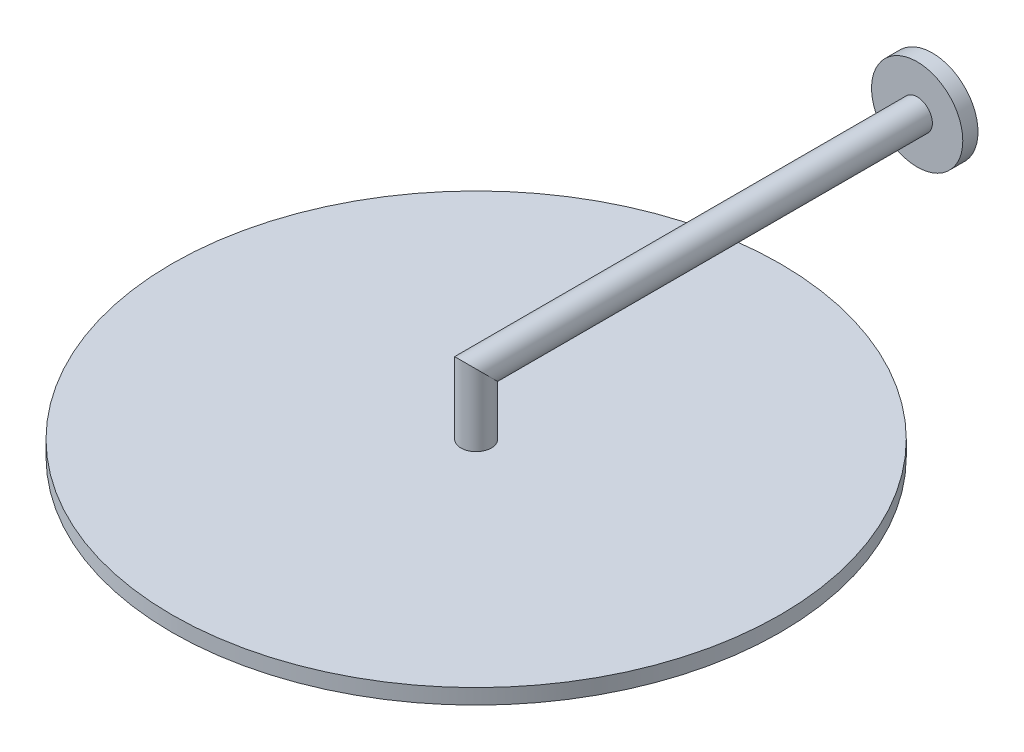
from build123d import *

# Parameters (mm, degrees)
SKETCH_1_R        = 30
EXTRUDE_1_DEPTH   = 10
SWEEP_1_PROFILE_R = 10
SKETCH_7_R        = 200
EXTRUDE_2_DEPTH   = 10


with BuildPart() as part:
    # Эскиз1 → Бобышка-Вытянуть1 (new body)
    with BuildSketch(Plane.XY):
        Circle(SKETCH_1_R)
    extrude(amount=EXTRUDE_1_DEPTH)

    # По траектории1: sweep along a curve in space
    with BuildLine() as sweep_1_path:
        Line((0, 0, 0), (0, 0, 300))
        Line((0, 0, 300), (0, -40, 300))
    # По траектории1 profile (on start of the path) → По траектории1 (sweep)
    with BuildSketch(Plane.XY):
        Circle(SWEEP_1_PROFILE_R)
    sweep(path=sweep_1_path.line, transition=Transition.RIGHT)

    # Эскиз7 → Бобышка-Вытянуть2 (add)
    with BuildSketch(Plane(origin=(0, -40, 0), x_dir=(-1, 0, 0), z_dir=(0, -1, 0))):
        with Locations(Location((0, -300, 0), (0, 0, 90))):
            Circle(SKETCH_7_R)
    extrude(amount=EXTRUDE_2_DEPTH)


solid = part.part
